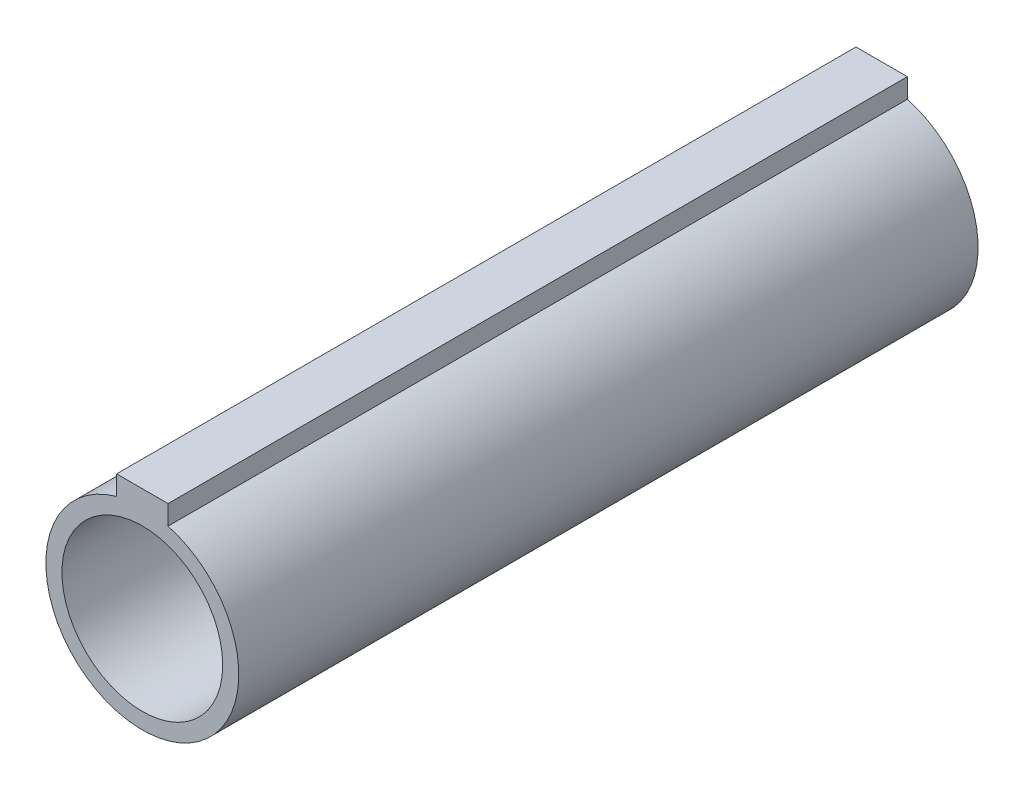
from build123d import *

# Parameters (mm, degrees)
SKETCH1_R           = 15
SKETCH1_R_2         = 12.5
BOSS_EXTRUDE1_DEPTH = 115
SKETCH2_W           = 8
SKETCH2_H           = 5
BOSS_EXTRUDE2_DEPTH = 115


with BuildPart() as part:
    # Sketch1 → Boss-Extrude1 (new body)
    with BuildSketch(Plane.XY):
        Circle(SKETCH1_R)
        Circle(SKETCH1_R_2, mode=Mode.SUBTRACT)
    extrude(amount=BOSS_EXTRUDE1_DEPTH)

    # Sketch2 → Boss-Extrude2 (add)
    with BuildSketch(Plane.XY):
        with Locations((0, 15)):
            Rectangle(SKETCH2_W, SKETCH2_H)
    extrude(amount=BOSS_EXTRUDE2_DEPTH)


solid = part.part
